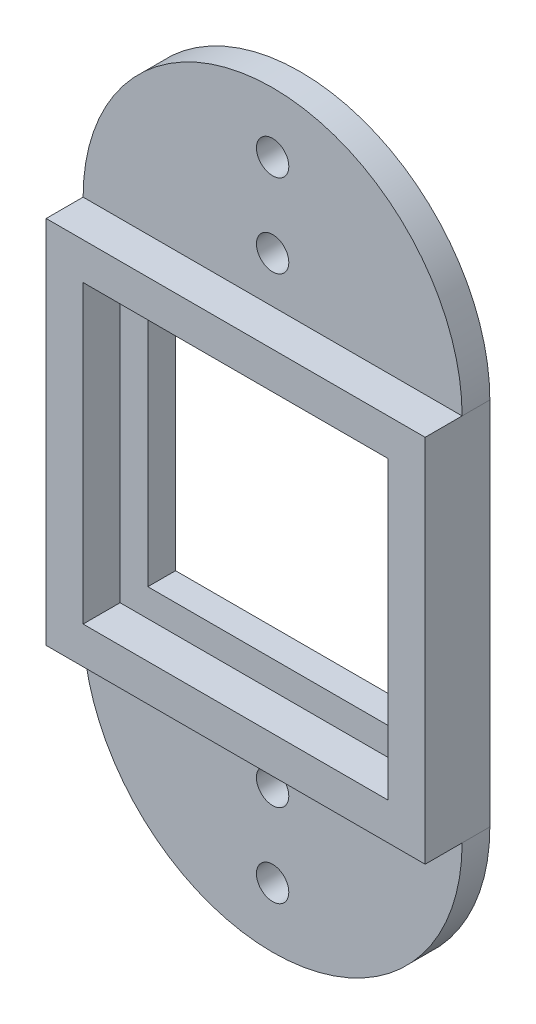
from build123d import *

# Parameters (mm, degrees)
SKETCH_1_W      = 41
SKETCH_1_H      = 40
SKETCH_1_W_2    = 33
SKETCH_1_H_2    = 32
EXTRUDE_5_DEPTH = 7
SKETCH_1_7_W    = 33
SKETCH_1_7_H    = 32
SKETCH_1_7_W_2  = 27
SKETCH_1_7_H_2  = 26
EXTRUDE_6_DEPTH = 3
SKETCH_1_9_R    = 1.75
EXTRUDE_7_DEPTH = 3


with BuildPart() as part:
    # 草图1 → 凸台-拉伸5 (new body)
    with BuildSketch(Plane.XY):
        with Locations((16.5, 16)):
            Rectangle(SKETCH_1_W, SKETCH_1_H)
        with Locations((16.5, 16)):
            Rectangle(SKETCH_1_W_2, SKETCH_1_H_2, mode=Mode.SUBTRACT)
    extrude(amount=EXTRUDE_5_DEPTH)

    # 草图1<7> → 凸台-拉伸6 (add)
    with BuildSketch(Plane.XY):
        with Locations((16.5, 16)):
            Rectangle(SKETCH_1_7_W, SKETCH_1_7_H)
        with Locations((16.5, 16)):
            Rectangle(SKETCH_1_7_W_2, SKETCH_1_7_H_2, mode=Mode.SUBTRACT)
    extrude(amount=EXTRUDE_6_DEPTH)

    # 草图1<9> → 凸台-拉伸7 (add)
    # profile 1 of 2: a face of its own
    with BuildSketch(Plane.XY):
        with BuildLine():
            ThreePointArc((37, 36), (16.5, 56.5), (-4, 36))
            Line((-4, 36), (37, 36))
        make_face()
        with Locations((16.5, 41)):
            Circle(SKETCH_1_9_R, mode=Mode.SUBTRACT)
        with Locations((16.5, 50)):
            Circle(SKETCH_1_9_R, mode=Mode.SUBTRACT)
    # profile 2 of 2: a face of its own
    with BuildSketch(Plane.XY):
        with BuildLine():
            Line((37, -4), (-4, -4))
            ThreePointArc((-4, -4), (16.5, -24.5), (37, -4))
        make_face()
        with Locations((16.5, -18)):
            Circle(SKETCH_1_9_R, mode=Mode.SUBTRACT)
        with Locations((16.5, -9)):
            Circle(SKETCH_1_9_R, mode=Mode.SUBTRACT)
    extrude(amount=EXTRUDE_7_DEPTH)


solid = part.part
